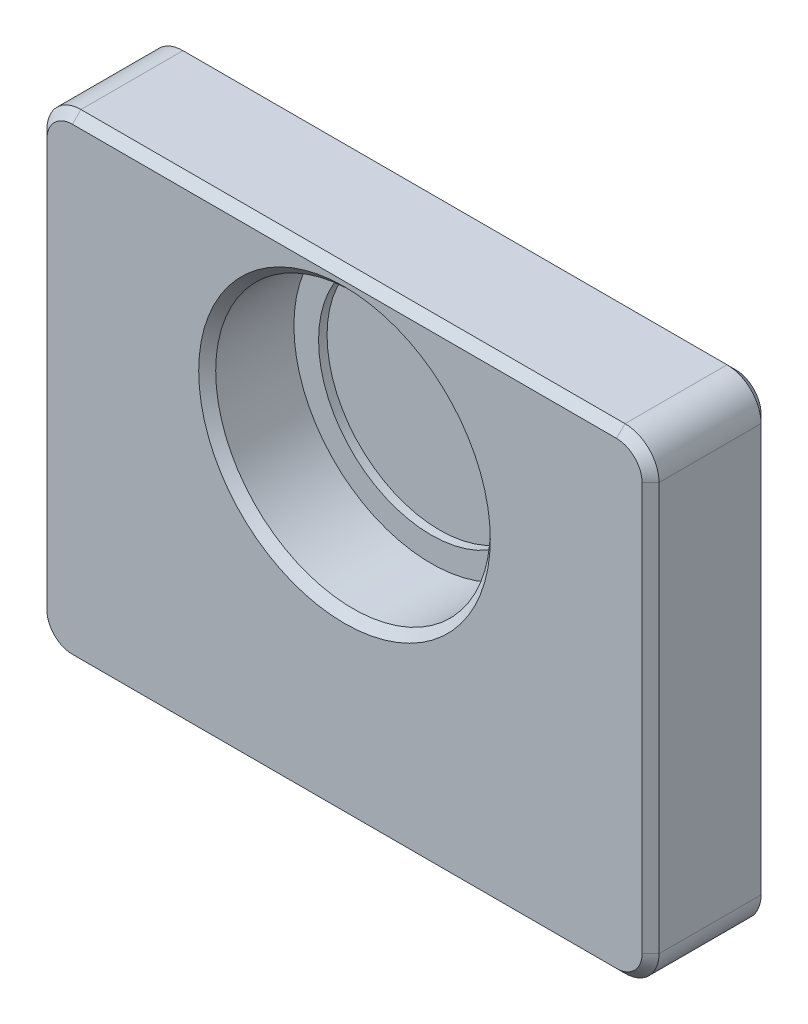
from build123d import *

# Parameters (mm, degrees)
SKIZZE1_W                       = 36
SKIZZE1_H                       = 28
AUFSATZ_LINEAR_AUSTRAGEN1_DEPTH = 7
SKIZZE2_R                       = 8.075
SCHNITT_LINEAR_AUSTRAGEN1_DEPTH = 5.6
AUFSATZ_LINEAR_START            = 0.5
SKIZZE10_R                      = 8.075
SKIZZE10_R_2                    = 6.625
AUFSATZ_LINEAR_AUSTRAGEN2_DEPTH = 0.5
VERRUNDUNG1_R                   = 2
SKIZZE11_R                      = 2.2
SCHNITT_LINEAR_AUSTRAGEN8_DEPTH = 8
FASE1_SIZE                      = 0.5


with BuildPart() as part:
    # Skizze1 → Aufsatz-Linear austragen1 (new body)
    with BuildSketch(Plane.XY):
        Rectangle(SKIZZE1_W, SKIZZE1_H)
    extrude(amount=AUFSATZ_LINEAR_AUSTRAGEN1_DEPTH)

    # Skizze2 → Schnitt-Linear austragen1 (cut)
    with BuildSketch(Plane.XY.offset(7)):
        with Locations((0, 4.65)):
            Circle(SKIZZE2_R)
    extrude(amount=-SCHNITT_LINEAR_AUSTRAGEN1_DEPTH, mode=Mode.SUBTRACT)

    # Skizze10 → Aufsatz-Linear austragen2 (add)
    with BuildSketch(Plane.XY.offset(1.4).offset(AUFSATZ_LINEAR_START)):
        with Locations((0, 4.65)):
            Circle(SKIZZE10_R)
        with Locations((0, 4.65)):
            Circle(SKIZZE10_R_2, mode=Mode.SUBTRACT)
    extrude(amount=-AUFSATZ_LINEAR_AUSTRAGEN2_DEPTH)

    # Verrundung1
    verrundung1_edges = [part.edges().sort_by_distance(p)[0] for p in [
        (18, 14, 3.5),
        (18, -14, 3.5),
        (-18, 14, 3.5),
        (-18, -14, 3.5),
    ]]
    fillet(verrundung1_edges, radius=VERRUNDUNG1_R)

    # Skizze11 → Schnitt-Linear austragen8 (cut)
    with BuildSketch(Plane.XZ.offset(14)):
        with Locations((0, 3.5)):
            Circle(SKIZZE11_R)
    extrude(amount=-SCHNITT_LINEAR_AUSTRAGEN8_DEPTH, mode=Mode.SUBTRACT)

    # Fase1
    fase1_edges = [part.edges().sort_by_distance(p)[0] for p in [
        (17.414213562, -13.414213562, 7),
        (0, -14, 7),
        (-17.414213562, -13.414213562, 7),
        (-18, 0, 7),
        (-17.414213562, 13.414213562, 7),
        (0, 14, 7),
        (17.414213562, 13.414213562, 7),
        (18, 0, 7),
        (-8.075, 4.65, 7),
        (-17.414213562, 13.414213562, 0),
        (-18, 0, 0),
        (-17.414213562, -13.414213562, 0),
        (0, -14, 0),
        (17.414213562, -13.414213562, 0),
        (18, 0, 0),
        (17.414213562, 13.414213562, 0),
        (0, 14, 0),
    ]]
    chamfer(fase1_edges, length=FASE1_SIZE)


solid = part.part
